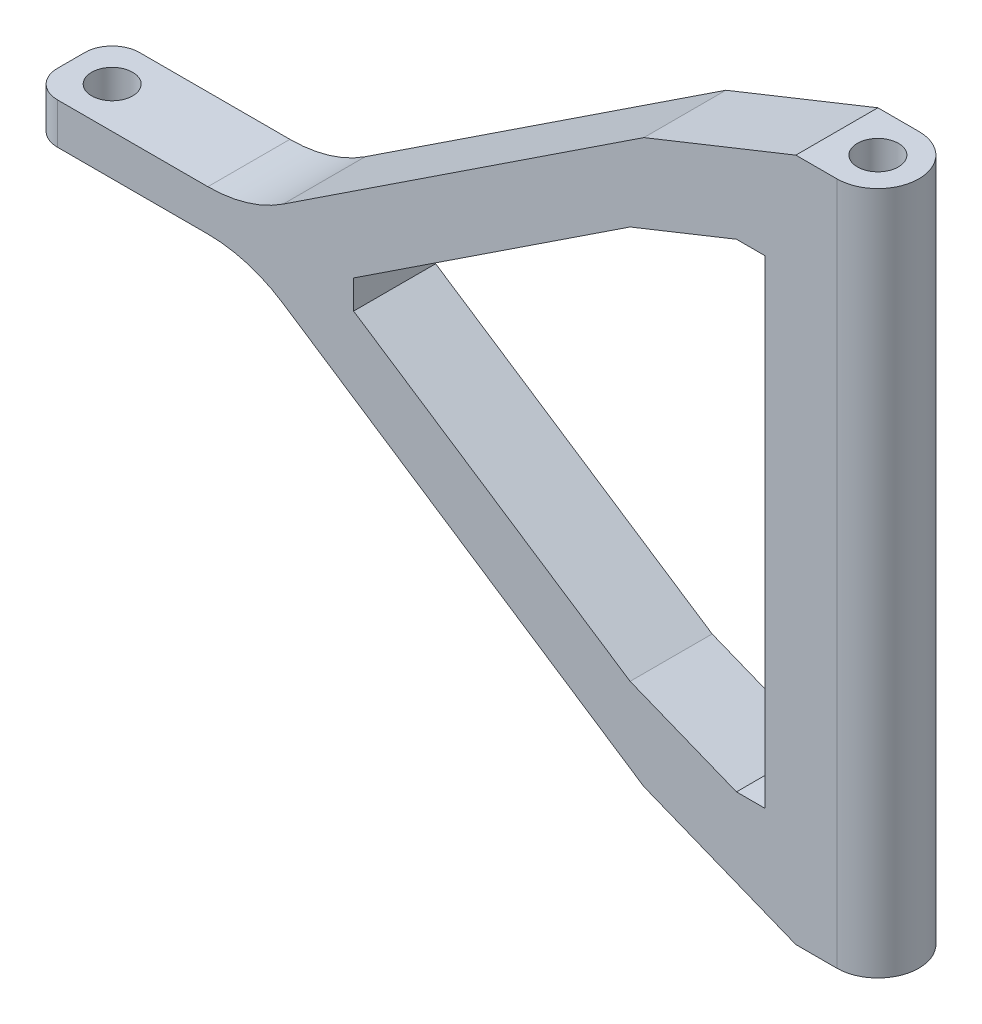
from build123d import *
from OCP.BRepFilletAPI import BRepFilletAPI_MakeChamfer

# Parameters (mm, degrees)
SKETCH1_R           = 1.5
BOSS_EXTRUDE1_DEPTH = 50
SKETCH2_W           = 6
SKETCH2_H           = 50
BOSS_EXTRUDE2_DEPTH = 50
CHAMFER1_SIZE       = 50
CHAMFER1_SIZE2      = 20
SKETCH4_W           = 6
SKETCH4_H           = 3
BOSS_EXTRUDE3_DEPTH = 6
SKETCH5_R           = 1.5
CUT_EXTRUDE1_DEPTH  = 65.747586828
CHAMFER2_SIZE       = 1
CHAMFER2_SIZE2      = 1.795054936
FILLET1_R           = 2
CUT_EXTRUDE2_DEPTH  = 6
CUT_EXTRUDE3_DEPTH  = 78.569323834
BOSS_EXTRUDE5_DEPTH = 6
CUT_EXTRUDE4_DEPTH  = 78.569323834
FILLET2_R           = 10


with BuildPart() as part:
    # Sketch1 → Boss-Extrude1 (new body)
    with BuildSketch(Plane(origin=(0, 0, 0), x_dir=(1, 0, 0), z_dir=(0, 1, 0))):
        with BuildLine():
            Line((0, 3), (-3, 3))
            Line((-3, 3), (-3, -3))
            Line((-3, -3), (0, -3))
            ThreePointArc((0, -3), (3, 0), (0, 3))
        make_face()
        with Locations(Location((0, 0, 0), (0, 0, 270))):
            Circle(SKETCH1_R, mode=Mode.SUBTRACT)
    extrude(amount=BOSS_EXTRUDE1_DEPTH)

    # Sketch2 → Boss-Extrude2 (add)
    with BuildSketch(Plane.ZY.offset(3)):
        with Locations((0, 25)):
            Rectangle(SKETCH2_W, SKETCH2_H)
    extrude(amount=BOSS_EXTRUDE2_DEPTH)

    # Chamfer1: one chamfer whose edges measure the first distance from different faces: ONE call of the kernel's chamfer builder (chamfer() names one face for all edges)
    chamfer1_edges_1 = [part.edges().sort_by_distance(p)[0] for p in [
        (-53, 50, 0),
    ]]
    chamfer1_side_1 = [part.faces().sort_by_distance(p)[0] for p in [
        (-25.86838725, 50, 0),
    ]]
    chamfer1_edges_2 = [part.edges().sort_by_distance(p)[0] for p in [
        (-53, 0, 0),
    ]]
    chamfer1_side_2 = [part.faces().sort_by_distance(p)[0] for p in [
        (-25.86838725, 0, 0),
    ]]
    chamfer1 = BRepFilletAPI_MakeChamfer(part.part.solid().wrapped)
    for e in chamfer1_edges_1:
        chamfer1.Add(CHAMFER1_SIZE, CHAMFER1_SIZE2, e.wrapped, chamfer1_side_1[0].wrapped)  # the first distance lies on this face
    for e in chamfer1_edges_2:
        chamfer1.Add(CHAMFER1_SIZE, CHAMFER1_SIZE2, e.wrapped, chamfer1_side_2[0].wrapped)  # the first distance lies on this face
    add(Compound.cast(chamfer1.Shape()), mode=Mode.REPLACE)

    # Sketch4 → Boss-Extrude3 (add)
    with BuildSketch(Plane.ZY.offset(53)):
        with Locations((0, 25)):
            Rectangle(SKETCH4_W, SKETCH4_H)
    extrude(amount=BOSS_EXTRUDE3_DEPTH)

    # Sketch5 → Cut-Extrude1 (cut, through all)
    with BuildSketch(Plane.XZ.offset(-23.5)):
        with Locations(Location((-56, 0, 0), (0, 0, 270))):
            Circle(SKETCH5_R)
    extrude(amount=-CUT_EXTRUDE1_DEPTH, mode=Mode.SUBTRACT)

    # Chamfer2: one chamfer whose edges measure the first distance from different faces: ONE call of the kernel's chamfer builder (chamfer() names one face for all edges)
    chamfer2_edges_1 = [part.edges().sort_by_distance(p)[0] for p in [
        (-53, 30, 0),
    ]]
    chamfer2_side_1 = [part.faces().sort_by_distance(p)[0] for p in [
        (-28, 40, 0),
    ]]
    chamfer2_edges_2 = [part.edges().sort_by_distance(p)[0] for p in [
        (-53, 20, 0),
    ]]
    chamfer2_side_2 = [part.faces().sort_by_distance(p)[0] for p in [
        (-28, 10, 0),
    ]]
    chamfer2 = BRepFilletAPI_MakeChamfer(part.part.solid().wrapped)
    for e in chamfer2_edges_1:
        chamfer2.Add(CHAMFER2_SIZE, CHAMFER2_SIZE2, e.wrapped, chamfer2_side_1[0].wrapped)  # the first distance lies on this face
    for e in chamfer2_edges_2:
        chamfer2.Add(CHAMFER2_SIZE, CHAMFER2_SIZE2, e.wrapped, chamfer2_side_2[0].wrapped)  # the first distance lies on this face
    add(Compound.cast(chamfer2.Shape()), mode=Mode.REPLACE)

    # Fillet1
    fillet1_edges = [part.edges().sort_by_distance(p)[0] for p in [
        (-59, 25, 3),
        (-59, 25, -3),
    ]]
    fillet(fillet1_edges, radius=FILLET1_R)

    # Sketch6 → Cut-Extrude2 (cut)
    with BuildSketch(Plane.XY.offset(3)):
        Polygon((-7.907152331, 5), (-5.507152331, 5), (-5.507152331, 45), (-7.907152331, 45), (-47.164370978, 29.297112541), (-47.907152331, 27.563956051), (-47.907152331, 22.436043949), (-47.164370978, 20.702887459), align=None)
    extrude(amount=-CUT_EXTRUDE2_DEPTH, mode=Mode.SUBTRACT)

    # Sketch7 → Cut-Extrude3 (cut, through all)
    with BuildSketch(Plane.XY.offset(3)):
        Polygon((-53, 28.204945064), (-53, 26.5), (-47.907152331, 26.5), (-47.907152331, 27.563956051), (-47.164370978, 29.297112541), (-25.810496084, 37.838662499), (-14.112413915, 45.555034434), (-52.071523309, 30.371390676), align=None)
        Polygon((-47.907152331, 23.5), (-53, 23.5), (-53, 21.795054936), (-52.071523309, 19.628609324), (-14.112413915, 4.444965566), (-25.810496084, 12.161337501), (-47.164370978, 20.702887459), (-47.907152331, 22.436043949), align=None)
    extrude(amount=-CUT_EXTRUDE3_DEPTH, mode=Mode.SUBTRACT)


with BuildPart() as cut_extrude3_piece_1:
    # of the separate pieces the step leaves, piece 1, a body of its own (cut_extrude3_pieces)
    add(part.part.solids().sort_by_distance((-3, 50, -3))[0])



with BuildPart() as cut_extrude3_piece_2:
    # of the separate pieces the step leaves, piece 2, a body of its own (cut_extrude3_pieces)
    add(part.part.solids().sort_by_distance((-57, 26.5, -3))[0])


with BuildPart() as cut_extrude3_piece_1_1:
    add(cut_extrude3_piece_1.part)

    add(cut_extrude3_piece_2.part)  # Boss-Extrude5 merges Cut-Extrude3 piece 2
    # Sketch7<3> → Boss-Extrude5 (add)
    with BuildSketch(Plane.XY.offset(3)):
        Polygon((-43, 26.5), (-53, 26.5), (-53, 23.5), (-43, 23.5), (-14.112413915, 4.444965566), (-3, 0), (-3, 50), (-14.112413915, 45.555034434), align=None)
    extrude(amount=-BOSS_EXTRUDE5_DEPTH)

    # Sketch8 → Cut-Extrude4 (cut, through all)
    with BuildSketch(Plane.XY.offset(3)):
        Polygon((-35.341555741, 26.05), (-15.120245482, 39.388524104), (-7.341555741, 42.5), (-5.241555741, 42.5), (-5.241555741, 7.5), (-7.341555741, 7.5), (-15.120245482, 10.611475896), (-35.341555741, 23.95), align=None)
    extrude(amount=-CUT_EXTRUDE4_DEPTH, mode=Mode.SUBTRACT)

    # Fillet2
    fillet2_edges = [cut_extrude3_piece_1_1.edges().sort_by_distance(p)[0] for p in [
        (-43, 23.5, 0),
        (-43, 26.5, 0),
    ]]
    fillet(fillet2_edges, radius=FILLET2_R)


solid = cut_extrude3_piece_1_1.part
